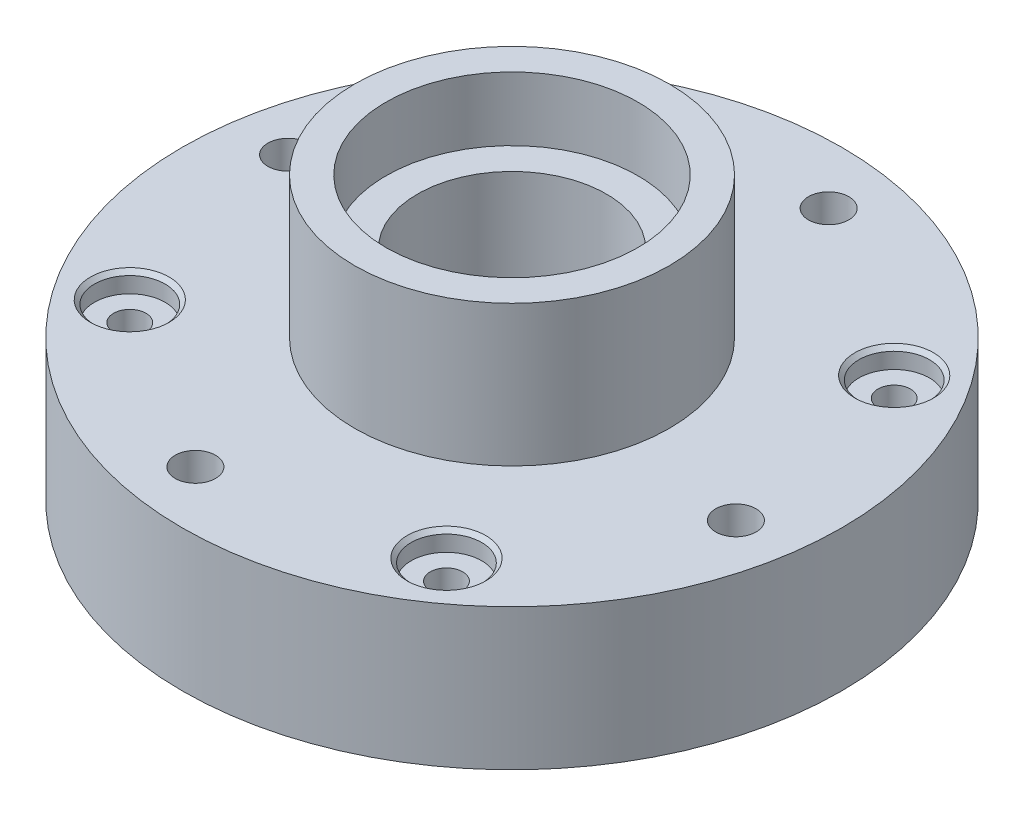
from build123d import *

# Parameters (mm, degrees)
CIRPATTERN1_COUNT = 4
CIRPATTERN2_COUNT = 4


with BuildPart() as part:
    # Sketch1 → Revolve2 (revolve)
    with BuildSketch(Plane.XY, mode=Mode.PRIVATE) as revolve2_sk:
        Polygon((19.839067821, 36.426477833), (24.767495434, 36.426477833), (24.767495434, 14.248399015), (51.887938783, 14.248399015), (51.887938783, -7.976600985), (14.87066517, -7.976600985), (14.87066517, 26.379705263), (19.839067821, 26.379705263), align=None)
    revolve(revolve2_sk.sketch.rotate(Axis((0, 36.426477833, 0), (0, -1, 0)), 90), axis=Axis((0, 36.426477833, 0), (0, -1, 0)))

    # Sketch4 → 1/4-20 Tapped Hole2 (revolve, cut)
    with BuildSketch(Plane(origin=(42.533479959, 14.248399015, 7.295039057), x_dir=(0, 0, 1), z_dir=(1, 0, 0))):
        Polygon((0, 0), (0, 18.043816902), (2.5527, 16.51), (2.5527, 12.7), (3.175, 12.7), (3.175, 0), align=None)
    f_1_4_20_tapped_hole2 = revolve(axis=Axis((42.533479959, 20.598399015, 7.295039057), (0, -1, 0)), mode=Mode.SUBTRACT)

    # CirPattern1: 1/4-20 Tapped Hole2 ×4 about axis
    cirpattern1_axis = Axis((0, 0, 0), (0, 1, 0))
    for i in range(1, CIRPATTERN1_COUNT):
        add(f_1_4_20_tapped_hole2.rotate(cirpattern1_axis, i * 360 / CIRPATTERN1_COUNT), mode=Mode.SUBTRACT)

    # Sketch7 → CBORE for #10 Binding Head Machine Screw1 (revolve, cut)
    with BuildSketch(Plane(origin=(35.234083692, 14.248399015, -24.91734052), x_dir=(0, 0, 1), z_dir=(1, 0, 0))):
        Polygon((0, 0), (0, 22.225), (2.5527, 22.225), (2.5527, 3.1242), (5.55625, 3.1242), (5.55625, 0.635), (6.19125, 0), align=None)
    cbore_for_10_binding_head_machine_screw = revolve(axis=Axis((35.234083692, 20.598399015, -24.91734052), (0, -1, 0)), mode=Mode.SUBTRACT)

    # CirPattern2: CBORE for #10 Binding Head Machine Screw1 ×4 about axis
    cirpattern2_axis = Axis((0, 0, 0), (0, 1, 0))
    for i in range(1, CIRPATTERN2_COUNT):
        add(cbore_for_10_binding_head_machine_screw.rotate(cirpattern2_axis, i * 360 / CIRPATTERN2_COUNT), mode=Mode.SUBTRACT)


solid = part.part
